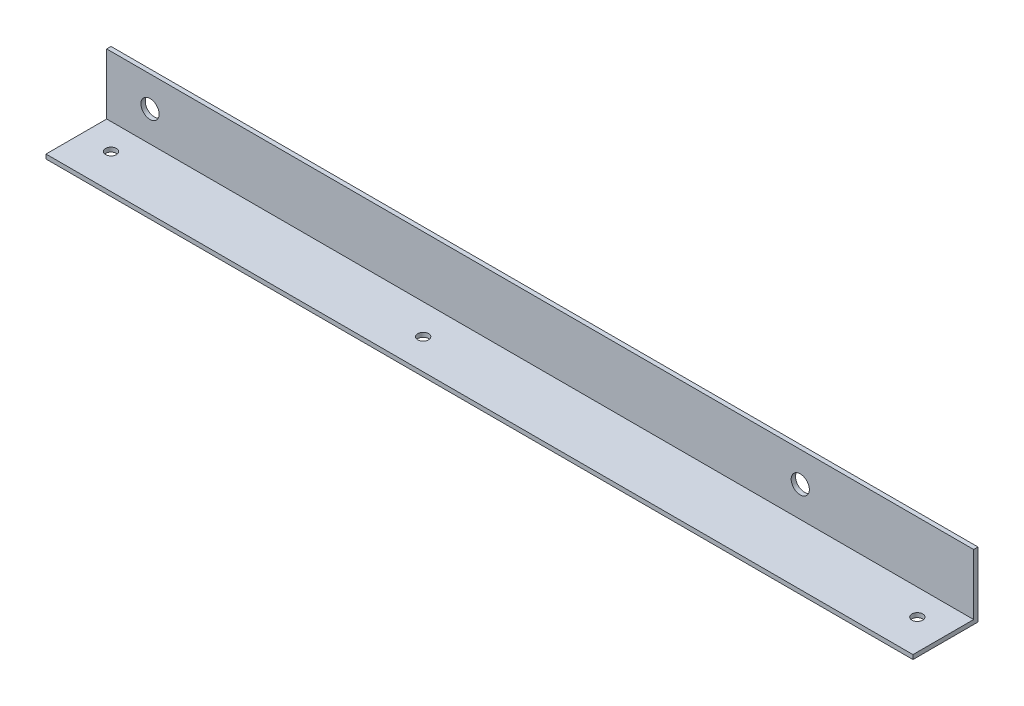
from build123d import *

# Parameters (mm, degrees)
SKETCH_1_W      = 200
SKETCH_1_H      = 15
EXTRUDE_1_DEPTH = 1
SKETCH_2_W      = 200
SKETCH_2_H      = 1
EXTRUDE_2_DEPTH = 14
M5X0_8_1_D      = 4.2
M3X0_5_1_D      = 2.5
M3X0_5_2_D      = 2.5


with BuildPart() as part:
    # ｽｹｯﾁ1 → ﾎﾞｽ - 押し出し1 (new body)
    with BuildSketch(Plane.XY):
        with Locations((100, 7.5)):
            Rectangle(SKETCH_1_W, SKETCH_1_H)
    extrude(amount=EXTRUDE_1_DEPTH)

    # ｽｹｯﾁ2 → ﾎﾞｽ - 押し出し2 (add)
    with BuildSketch(Plane.XY.offset(1)):
        with Locations((100, 0.5)):
            Rectangle(SKETCH_2_W, SKETCH_2_H)
    extrude(amount=EXTRUDE_2_DEPTH)

    # M5x0.8 ねじ穴1 (through all)
    with Locations(Plane(origin=(0, 0, 0), x_dir=(-1, 0, 0), z_dir=(0, 0, -1))):
        with Locations((-10, 8), (-160, 8)):
            Hole(M5X0_8_1_D / 2)

    # M3x0.5 ねじ穴1 (through all)
    with Locations(Plane(origin=(0, 0, 0), x_dir=(-1, 0, 0), z_dir=(0, -1, 0))):
        with Locations((-193, -7)):
            m3x0_5_1 = Hole(M3X0_5_1_D / 2)

    # M3x0.5 ねじ穴2 (through all)
    with Locations(Plane(origin=(0, 1, 0), x_dir=(1, 0, 0), z_dir=(0, 1, 0))):
        with Locations((80, -8)):
            Hole(M3X0_5_2_D / 2)

    # ﾐﾗｰ2: M3x0.5 ねじ穴1 across plane
    add(m3x0_5_1.mirror(Plane(origin=(100, 0, 0), x_dir=(0, 0, 1), z_dir=(1, 0, 0))), mode=Mode.SUBTRACT)


solid = part.part
